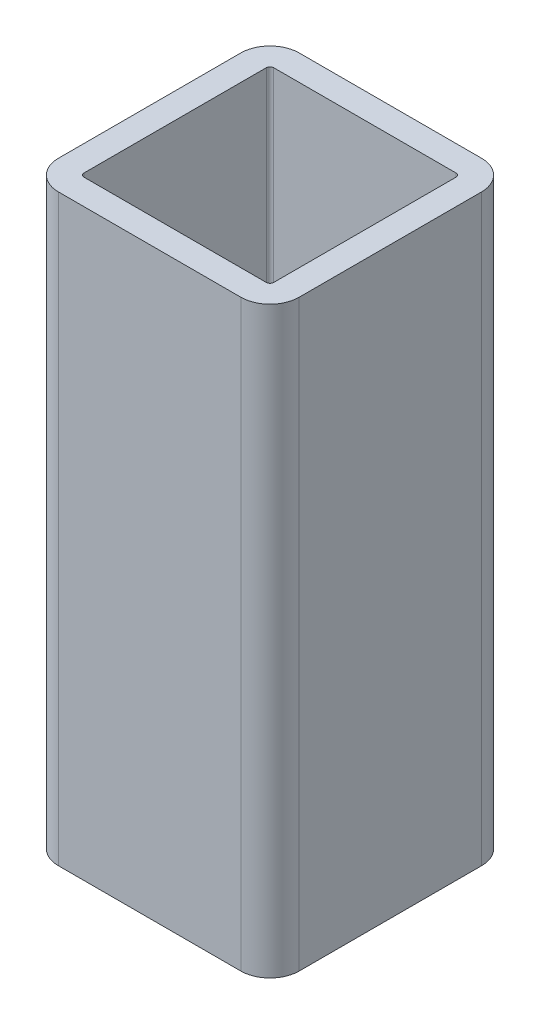
from build123d import *

# Parameters (mm, degrees)
BOSS_EXTRUDE1_DEPTH = 127


with BuildPart() as part:
    # Sketch1 → Boss-Extrude1 (new body)
    with BuildSketch(Plane(origin=(0, 0, 0), x_dir=(1, 0, 0), z_dir=(0, 1, 0))):
        with BuildLine():
            Line((-16.286574074, 23.283333333), (23.400925926, 23.283333333))
            ThreePointArc((23.400925926, 23.283333333), (27.891053986, 21.423461394), (29.750925926, 16.933333333))
            Line((29.750925926, 16.933333333), (29.750925926, -22.754166667))
            ThreePointArc((29.750925926, -22.754166667), (27.891053986, -27.244294727), (23.400925926, -29.104166667))
            Line((23.400925926, -29.104166667), (-16.286574074, -29.104166667))
            ThreePointArc((-16.286574074, -29.104166667), (-20.776702135, -27.244294727), (-22.636574074, -22.754166667))
            Line((-22.636574074, -22.754166667), (-22.636574074, 16.933333333))
            ThreePointArc((-22.636574074, 16.933333333), (-20.776702135, 21.423461394), (-16.286574074, 23.283333333))
        make_face()
        with BuildLine():
            Line((24.194675926, 16.933333333), (24.194675926, -22.754166667))
            ThreePointArc((24.194675926, -22.754166667), (23.962191933, -23.315432674), (23.400925926, -23.547916667))
            Line((23.400925926, -23.547916667), (-16.286574074, -23.547916667))
            ThreePointArc((-16.286574074, -23.547916667), (-16.847840082, -23.315432674), (-17.080324074, -22.754166667))
            Line((-17.080324074, -22.754166667), (-17.080324074, 16.933333333))
            ThreePointArc((-17.080324074, 16.933333333), (-16.847840082, 17.494599341), (-16.286574074, 17.727083333))
            Line((-16.286574074, 17.727083333), (23.400925926, 17.727083333))
            ThreePointArc((23.400925926, 17.727083333), (23.962191933, 17.494599341), (24.194675926, 16.933333333))
        make_face(mode=Mode.SUBTRACT)
    extrude(amount=BOSS_EXTRUDE1_DEPTH)


solid = part.part
